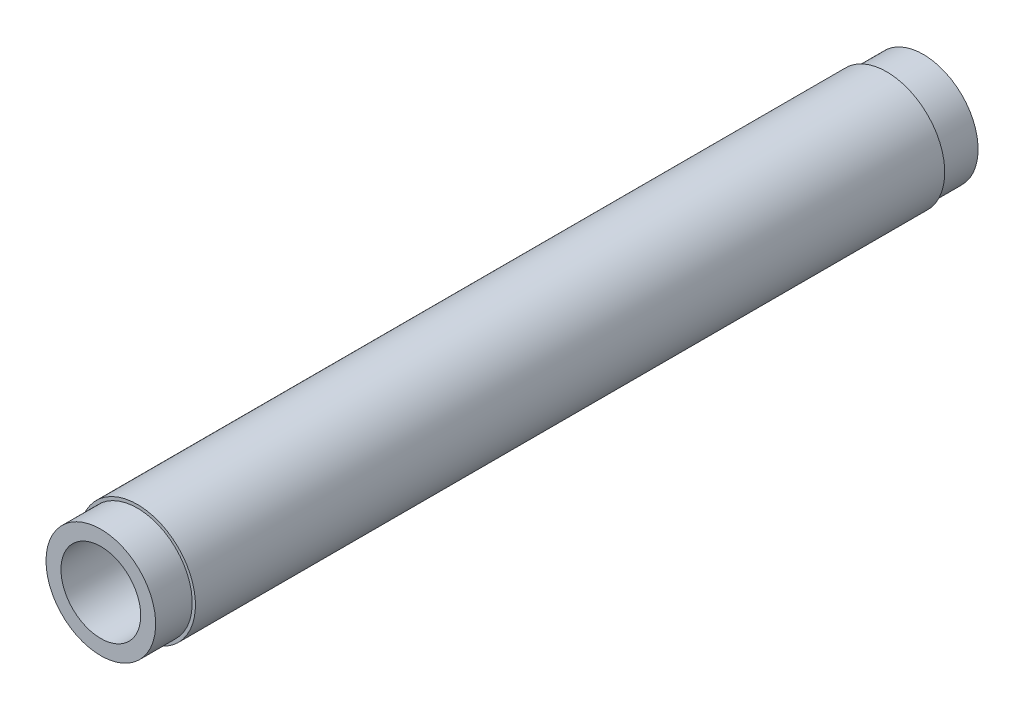
from build123d import *

# Parameters (mm, degrees)
EXTRUDE1_DEPTH          = 45
EXTRUDE1_DEPTH_BACK     = 45
SKETCH1_R               = 6
EXTRUDE2_DEPTH          = 41
EXTRUDE2_DEPTH_BACK     = 41
SKETCH2_R               = 6.35
CUT_EXTRUDE1_DEPTH      = 46.887307613
CUT_EXTRUDE1_DEPTH_BACK = 46.887307613
SKETCH3_R               = 4.365


with BuildPart() as part:
    # Sketch1 → Extrude1 (new, two sides: drawn at the far end of the back side and taken through both)
    with BuildSketch(Plane.XY.offset(-EXTRUDE1_DEPTH_BACK)):
        with Locations(Location((0, 0, 0), (0, 0, 180))):
            Circle(SKETCH1_R)
    extrude(amount=EXTRUDE1_DEPTH + EXTRUDE1_DEPTH_BACK)

    # Sketch2 → Extrude2 (add, two sides: drawn at the far end of the back side and taken through both)
    with BuildSketch(Plane.XY.offset(-EXTRUDE2_DEPTH_BACK)):
        with Locations(Location((0, 0, 0), (0, 0, 180))):
            Circle(SKETCH2_R)
    extrude(amount=EXTRUDE2_DEPTH + EXTRUDE2_DEPTH_BACK)

    # Sketch3 → Cut-Extrude1 (cut, two sides: drawn at the far end of the back side and taken through both)
    with BuildSketch(Plane.XY.offset(-CUT_EXTRUDE1_DEPTH_BACK)):
        Circle(SKETCH3_R)
    extrude(amount=CUT_EXTRUDE1_DEPTH + CUT_EXTRUDE1_DEPTH_BACK, mode=Mode.SUBTRACT)


solid = part.part
